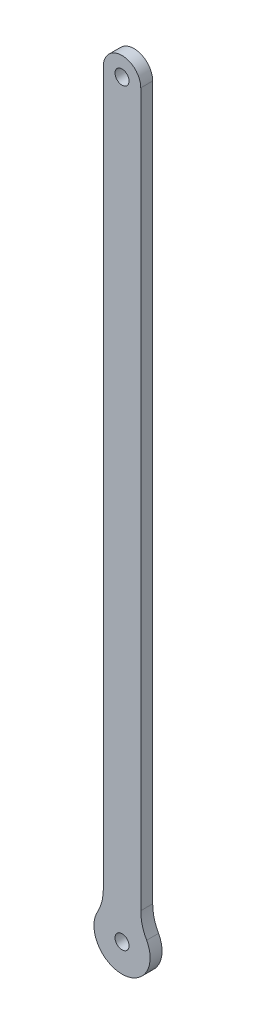
from build123d import *

# Parameters (mm, degrees)
MODEL_R             = 1.5
BOSS_EXTRUDE1_DEPTH = 2.55


with BuildPart() as part:
    # Model → Boss-Extrude1 (new body)
    with BuildSketch(Plane.XY):
        with BuildLine():
            Line((-4, 8.512011392), (-4, 7.745966692))
            ThreePointArc((-4, 7.745966692), (-4.317541634, 5.245966692), (-5.25, 2.90473751))
            ThreePointArc((-5.25, 2.90473751), (0, -6), (5.25, 2.90473751))
            ThreePointArc((5.25, 2.90473751), (4.317541634, 5.245966692), (4, 7.745966692))
            Line((4, 7.745966692), (4, 8.785724032))
            Line((4, 8.785724032), (4, 160))
            ThreePointArc((4, 160), (0, 164), (-4, 160))
            Line((-4, 160), (-4, 8.512011392))
        make_face()
        Circle(MODEL_R, mode=Mode.SUBTRACT)
        with Locations((0, 160)):
            Circle(MODEL_R, mode=Mode.SUBTRACT)
    extrude(amount=BOSS_EXTRUDE1_DEPTH)


solid = part.part
